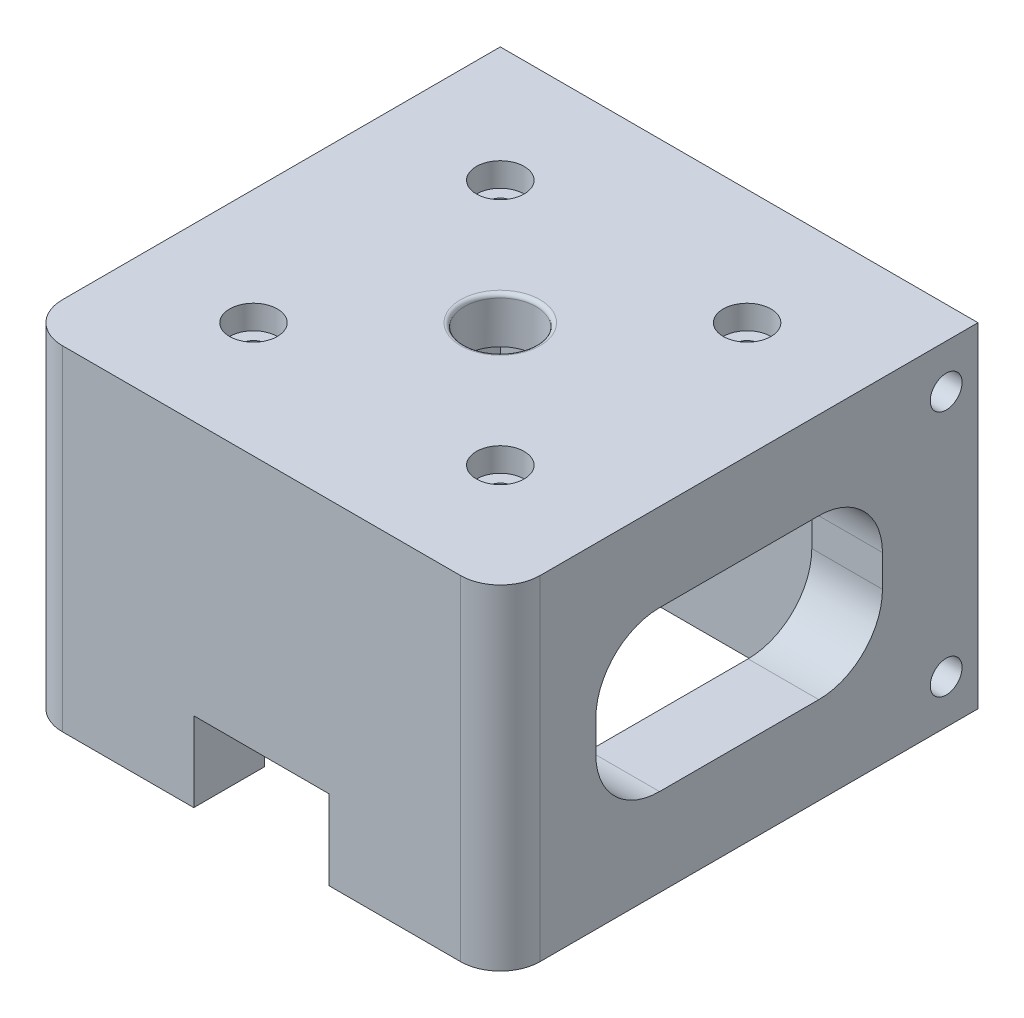
from build123d import *

# Parameters (mm, degrees)
SKETCH1_W           = 60
SKETCH1_H           = 60
BOSS_EXTRUDE1_DEPTH = 8
SKETCH2_R           = 4.5
CUT_EXTRUDE1_DEPTH  = 8
SKETCH3_R           = 11
CUT_EXTRUDE2_DEPTH  = 2.2
SKETCH4_R           = 1.5
CUT_EXTRUDE3_DEPTH  = 11.2
SKETCH6_R           = 3
CUT_EXTRUDE4_DEPTH  = 3
SKETCH7_W           = 60
SKETCH7_H           = 60
SKETCH7_W_2         = 42.25
SKETCH7_H_2         = 42.25
BOSS_EXTRUDE3_DEPTH = 34
SKETCH8_W           = 17
SKETCH8_H           = 8.88
CUT_EXTRUDE5_DEPTH  = 10
SKETCH9_W           = 36
SKETCH9_H           = 20
CUT_EXTRUDE6_DEPTH  = 60
FILLET1_R           = 0.5
FILLET2_R           = 8
FILLET3_R           = 5
SKETCH10_R          = 2
CUT_EXTRUDE7_DEPTH  = 14
CUT_EXTRUDE8_START  = -14
SKETCH11_R          = 2
CUT_EXTRUDE8_DEPTH  = 14


with BuildPart() as part:
    # Sketch1 → Boss-Extrude1 (new body)
    with BuildSketch(Plane(origin=(0, 0, 0), x_dir=(1, 0, 0), z_dir=(0, 1, 0))):
        Rectangle(SKETCH1_W, SKETCH1_H)
    extrude(amount=BOSS_EXTRUDE1_DEPTH)

    # Sketch2 → Cut-Extrude1 (cut)
    with BuildSketch(Plane(origin=(0, 8, 0), x_dir=(1, 0, 0), z_dir=(0, 1, 0))):
        with Locations(Location((0, 0, 0), (0, 0, 270))):
            Circle(SKETCH2_R)
    extrude(amount=-CUT_EXTRUDE1_DEPTH, mode=Mode.SUBTRACT)

    # Sketch3 → Cut-Extrude2 (cut)
    with BuildSketch(Plane.XZ):
        with Locations(Location((0, 0, 0), (0, 0, 270))):
            Circle(SKETCH3_R)
    extrude(amount=-CUT_EXTRUDE2_DEPTH, mode=Mode.SUBTRACT)

    # Sketch4 → Cut-Extrude3 (cut)
    with BuildSketch(Plane.XZ):
        with Locations(Location((-15.5, 15.5, 0), (0, 0, 270))):
            Circle(SKETCH4_R)
        with Locations(Location((-15.5, -15.5, 0), (0, 0, 270))):
            Circle(SKETCH4_R)
        with Locations(Location((15.5, -15.5, 0), (0, 0, 270))):
            Circle(SKETCH4_R)
        with Locations(Location((15.5, 15.5, 0), (0, 0, 270))):
            Circle(SKETCH4_R)
    extrude(amount=-CUT_EXTRUDE3_DEPTH, mode=Mode.SUBTRACT)

    # Sketch6 → Cut-Extrude4 (cut)
    with BuildSketch(Plane(origin=(0, 8, 0), x_dir=(1, 0, 0), z_dir=(0, 1, 0))):
        with Locations(Location((-15.5, 15.5, 0), (0, 0, 270))):
            Circle(SKETCH6_R)
        with Locations(Location((15.5, 15.5, 0), (0, 0, 270))):
            Circle(SKETCH6_R)
        with Locations(Location((-15.5, -15.5, 0), (0, 0, 270))):
            Circle(SKETCH6_R)
        with Locations(Location((15.5, -15.5, 0), (0, 0, 270))):
            Circle(SKETCH6_R)
    extrude(amount=-CUT_EXTRUDE4_DEPTH, mode=Mode.SUBTRACT)

    # Sketch7 → Boss-Extrude3 (add)
    with BuildSketch(Plane.XZ):
        Rectangle(SKETCH7_W, SKETCH7_H)
        Rectangle(SKETCH7_W_2, SKETCH7_H_2, mode=Mode.SUBTRACT)
    extrude(amount=BOSS_EXTRUDE3_DEPTH)

    # Sketch8 → Cut-Extrude5 (cut)
    with BuildSketch(Plane.XZ.offset(34)):
        with Locations((0, 25.56)):
            Rectangle(SKETCH8_W, SKETCH8_H)
    extrude(amount=-CUT_EXTRUDE5_DEPTH, mode=Mode.SUBTRACT)

    # Sketch9 → Cut-Extrude6 (cut)
    with BuildSketch(Plane(origin=(30, 0, 0), x_dir=(0, 0, -1), z_dir=(1, 0, 0))):
        with Locations((0, -13)):
            Rectangle(SKETCH9_W, SKETCH9_H)
    extrude(amount=-CUT_EXTRUDE6_DEPTH, mode=Mode.SUBTRACT)

    # Fillet1
    fillet1_edges = [part.edges().sort_by_distance(p)[0] for p in [
        (0, 8, -4.5),
    ]]
    fillet(fillet1_edges, radius=FILLET1_R)

    # Fillet2
    fillet2_edges = [part.edges().sort_by_distance(p)[0] for p in [
        (-25.5625, -23, 18),
        (-25.5625, -3, 18),
        (-25.5625, -3, -18),
        (-25.5625, -23, -18),
        (25.5625, -23, 18),
        (25.5625, -3, 18),
        (25.5625, -3, -18),
        (25.5625, -23, -18),
    ]]
    fillet(fillet2_edges, radius=FILLET2_R)

    # Fillet3
    fillet3_edges = [part.edges().sort_by_distance(p)[0] for p in [
        (30, -13, 30),
        (-30, -13, 30),
    ]]
    fillet(fillet3_edges, radius=FILLET3_R)

    # Sketch10 → Cut-Extrude7 (cut)
    with BuildSketch(Plane(origin=(30, 0, 0), x_dir=(0, 0, -1), z_dir=(1, 0, 0))):
        with Locations((26, -28.5)):
            Circle(SKETCH10_R)
        with Locations((26, 2.5)):
            Circle(SKETCH10_R)
    extrude(amount=-CUT_EXTRUDE7_DEPTH, mode=Mode.SUBTRACT)

    # Sketch11 → Cut-Extrude8 (cut)
    with BuildSketch(Plane.ZY.offset(30).offset(CUT_EXTRUDE8_START)):
        with Locations(Location((-26, 2.5, 0), (0, 0, 180))):
            Circle(SKETCH11_R)
        with Locations(Location((-26, -28.5, 0), (0, 0, 180))):
            Circle(SKETCH11_R)
    extrude(amount=CUT_EXTRUDE8_DEPTH, mode=Mode.SUBTRACT)


solid = part.part
